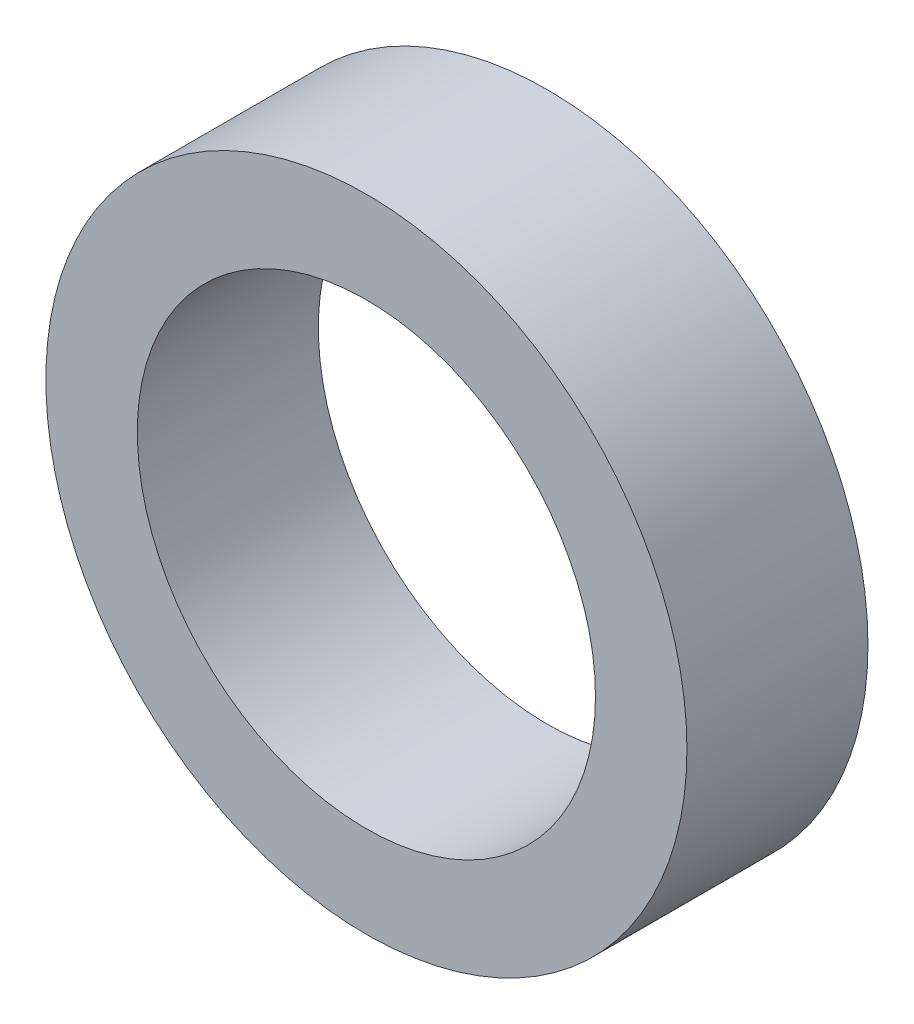
from build123d import *

# Parameters (mm, degrees)
S01_ANNULAR_SECTION_R      = 8.5
S01_ANNULAR_SECTION_R_2    = 6.075
F_01_ANNULAR_SECTION_DEPTH = 4.8


with BuildPart() as part:
    # S01 - Annular section → 01 - Annular section (new body)
    with BuildSketch(Plane.XY):
        Circle(S01_ANNULAR_SECTION_R)
        Circle(S01_ANNULAR_SECTION_R_2, mode=Mode.SUBTRACT)
    extrude(amount=F_01_ANNULAR_SECTION_DEPTH)


solid = part.part
